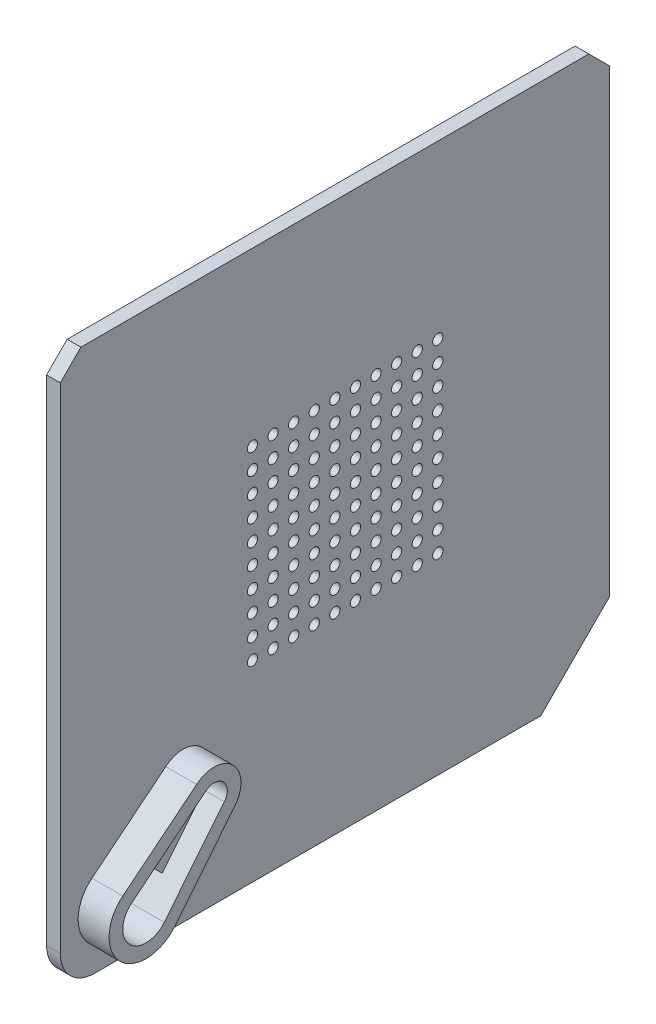
from build123d import *
from build123d.topology import SkipClean

# Parameters (mm, degrees)
SKETCH_1_R          = 0.75
EXTRUDE_1_DEPTH     = 2
EXTRUDE_2_DEPTH     = 1.5
EXTRUDE_3_DEPTH     = 1.5
CUT_EXTRUDE_1_DEPTH = 1.5
EXTRUDE_4_DEPTH     = 3
EXTRUDE_START       = 2
EXTRUDE_5_DEPTH     = 2


with BuildPart() as part:
    # 草图1 → 凸台-拉伸1 (new body)
    with BuildSketch(Plane(origin=(0, 0, 0), x_dir=(0, 0, -1), z_dir=(1, 0, 0))):
        with BuildLine():
            Line((70, 0), (80, 10))
            Line((80, 10), (80, 77))
            Line((80, 77), (77, 80))
            Line((77, 80), (3, 80))
            Line((3, 80), (0, 77))
            Line((0, 77), (0, 5))
            ThreePointArc((0, 5), (1.464466094, 1.464466094), (5, 0))
            Line((5, 0), (70, 0))
        make_face()
        with Locations((28, 55)):
            Circle(SKETCH_1_R, mode=Mode.SUBTRACT)
        with Locations((28, 52)):
            Circle(SKETCH_1_R, mode=Mode.SUBTRACT)
        with Locations((28, 49)):
            Circle(SKETCH_1_R, mode=Mode.SUBTRACT)
        with Locations((28, 46)):
            Circle(SKETCH_1_R, mode=Mode.SUBTRACT)
        with Locations((28, 43)):
            Circle(SKETCH_1_R, mode=Mode.SUBTRACT)
        with Locations((28, 40)):
            Circle(SKETCH_1_R, mode=Mode.SUBTRACT)
        with Locations((28, 37)):
            Circle(SKETCH_1_R, mode=Mode.SUBTRACT)
        with Locations((28, 34)):
            Circle(SKETCH_1_R, mode=Mode.SUBTRACT)
        with Locations((28, 31)):
            Circle(SKETCH_1_R, mode=Mode.SUBTRACT)
        with Locations((28, 28)):
            Circle(SKETCH_1_R, mode=Mode.SUBTRACT)
        with Locations((31, 52)):
            Circle(SKETCH_1_R, mode=Mode.SUBTRACT)
        with Locations((31, 49)):
            Circle(SKETCH_1_R, mode=Mode.SUBTRACT)
        with Locations((31, 46)):
            Circle(SKETCH_1_R, mode=Mode.SUBTRACT)
        with Locations((31, 43)):
            Circle(SKETCH_1_R, mode=Mode.SUBTRACT)
        with Locations((31, 40)):
            Circle(SKETCH_1_R, mode=Mode.SUBTRACT)
        with Locations((31, 37)):
            Circle(SKETCH_1_R, mode=Mode.SUBTRACT)
        with Locations((31, 34)):
            Circle(SKETCH_1_R, mode=Mode.SUBTRACT)
        with Locations((31, 31)):
            Circle(SKETCH_1_R, mode=Mode.SUBTRACT)
        with Locations((31, 28)):
            Circle(SKETCH_1_R, mode=Mode.SUBTRACT)
        with Locations((34, 52)):
            Circle(SKETCH_1_R, mode=Mode.SUBTRACT)
        with Locations((34, 49)):
            Circle(SKETCH_1_R, mode=Mode.SUBTRACT)
        with Locations((34, 46)):
            Circle(SKETCH_1_R, mode=Mode.SUBTRACT)
        with Locations((34, 43)):
            Circle(SKETCH_1_R, mode=Mode.SUBTRACT)
        with Locations((34, 40)):
            Circle(SKETCH_1_R, mode=Mode.SUBTRACT)
        with Locations((34, 37)):
            Circle(SKETCH_1_R, mode=Mode.SUBTRACT)
        with Locations((34, 34)):
            Circle(SKETCH_1_R, mode=Mode.SUBTRACT)
        with Locations((34, 31)):
            Circle(SKETCH_1_R, mode=Mode.SUBTRACT)
        with Locations((34, 28)):
            Circle(SKETCH_1_R, mode=Mode.SUBTRACT)
        with Locations((37, 52)):
            Circle(SKETCH_1_R, mode=Mode.SUBTRACT)
        with Locations((37, 49)):
            Circle(SKETCH_1_R, mode=Mode.SUBTRACT)
        with Locations((37, 46)):
            Circle(SKETCH_1_R, mode=Mode.SUBTRACT)
        with Locations((37, 43)):
            Circle(SKETCH_1_R, mode=Mode.SUBTRACT)
        with Locations((37, 40)):
            Circle(SKETCH_1_R, mode=Mode.SUBTRACT)
        with Locations((37, 37)):
            Circle(SKETCH_1_R, mode=Mode.SUBTRACT)
        with Locations((37, 34)):
            Circle(SKETCH_1_R, mode=Mode.SUBTRACT)
        with Locations((37, 31)):
            Circle(SKETCH_1_R, mode=Mode.SUBTRACT)
        with Locations((37, 28)):
            Circle(SKETCH_1_R, mode=Mode.SUBTRACT)
        with Locations((40, 52)):
            Circle(SKETCH_1_R, mode=Mode.SUBTRACT)
        with Locations((40, 49)):
            Circle(SKETCH_1_R, mode=Mode.SUBTRACT)
        with Locations((40, 46)):
            Circle(SKETCH_1_R, mode=Mode.SUBTRACT)
        with Locations((40, 43)):
            Circle(SKETCH_1_R, mode=Mode.SUBTRACT)
        with Locations((40, 40)):
            Circle(SKETCH_1_R, mode=Mode.SUBTRACT)
        with Locations((40, 37)):
            Circle(SKETCH_1_R, mode=Mode.SUBTRACT)
        with Locations((40, 34)):
            Circle(SKETCH_1_R, mode=Mode.SUBTRACT)
        with Locations((40, 31)):
            Circle(SKETCH_1_R, mode=Mode.SUBTRACT)
        with Locations((40, 28)):
            Circle(SKETCH_1_R, mode=Mode.SUBTRACT)
        with Locations((43, 52)):
            Circle(SKETCH_1_R, mode=Mode.SUBTRACT)
        with Locations((43, 49)):
            Circle(SKETCH_1_R, mode=Mode.SUBTRACT)
        with Locations((43, 46)):
            Circle(SKETCH_1_R, mode=Mode.SUBTRACT)
        with Locations((43, 43)):
            Circle(SKETCH_1_R, mode=Mode.SUBTRACT)
        with Locations((43, 40)):
            Circle(SKETCH_1_R, mode=Mode.SUBTRACT)
        with Locations((43, 37)):
            Circle(SKETCH_1_R, mode=Mode.SUBTRACT)
        with Locations((43, 34)):
            Circle(SKETCH_1_R, mode=Mode.SUBTRACT)
        with Locations((43, 31)):
            Circle(SKETCH_1_R, mode=Mode.SUBTRACT)
        with Locations((43, 28)):
            Circle(SKETCH_1_R, mode=Mode.SUBTRACT)
        with Locations((46, 52)):
            Circle(SKETCH_1_R, mode=Mode.SUBTRACT)
        with Locations((46, 49)):
            Circle(SKETCH_1_R, mode=Mode.SUBTRACT)
        with Locations((46, 46)):
            Circle(SKETCH_1_R, mode=Mode.SUBTRACT)
        with Locations((46, 43)):
            Circle(SKETCH_1_R, mode=Mode.SUBTRACT)
        with Locations((46, 40)):
            Circle(SKETCH_1_R, mode=Mode.SUBTRACT)
        with Locations((46, 37)):
            Circle(SKETCH_1_R, mode=Mode.SUBTRACT)
        with Locations((46, 34)):
            Circle(SKETCH_1_R, mode=Mode.SUBTRACT)
        with Locations((46, 31)):
            Circle(SKETCH_1_R, mode=Mode.SUBTRACT)
        with Locations((46, 28)):
            Circle(SKETCH_1_R, mode=Mode.SUBTRACT)
        with Locations((49, 52)):
            Circle(SKETCH_1_R, mode=Mode.SUBTRACT)
        with Locations((49, 49)):
            Circle(SKETCH_1_R, mode=Mode.SUBTRACT)
        with Locations((49, 46)):
            Circle(SKETCH_1_R, mode=Mode.SUBTRACT)
        with Locations((49, 43)):
            Circle(SKETCH_1_R, mode=Mode.SUBTRACT)
        with Locations((49, 40)):
            Circle(SKETCH_1_R, mode=Mode.SUBTRACT)
        with Locations((49, 37)):
            Circle(SKETCH_1_R, mode=Mode.SUBTRACT)
        with Locations((49, 34)):
            Circle(SKETCH_1_R, mode=Mode.SUBTRACT)
        with Locations((49, 31)):
            Circle(SKETCH_1_R, mode=Mode.SUBTRACT)
        with Locations((49, 28)):
            Circle(SKETCH_1_R, mode=Mode.SUBTRACT)
        with Locations((52, 52)):
            Circle(SKETCH_1_R, mode=Mode.SUBTRACT)
        with Locations((52, 49)):
            Circle(SKETCH_1_R, mode=Mode.SUBTRACT)
        with Locations((52, 46)):
            Circle(SKETCH_1_R, mode=Mode.SUBTRACT)
        with Locations((52, 43)):
            Circle(SKETCH_1_R, mode=Mode.SUBTRACT)
        with Locations((52, 40)):
            Circle(SKETCH_1_R, mode=Mode.SUBTRACT)
        with Locations((52, 37)):
            Circle(SKETCH_1_R, mode=Mode.SUBTRACT)
        with Locations((52, 34)):
            Circle(SKETCH_1_R, mode=Mode.SUBTRACT)
        with Locations((52, 31)):
            Circle(SKETCH_1_R, mode=Mode.SUBTRACT)
        with Locations((52, 28)):
            Circle(SKETCH_1_R, mode=Mode.SUBTRACT)
        with Locations((55, 52)):
            Circle(SKETCH_1_R, mode=Mode.SUBTRACT)
        with Locations((55, 49)):
            Circle(SKETCH_1_R, mode=Mode.SUBTRACT)
        with Locations((55, 46)):
            Circle(SKETCH_1_R, mode=Mode.SUBTRACT)
        with Locations((55, 43)):
            Circle(SKETCH_1_R, mode=Mode.SUBTRACT)
        with Locations((55, 40)):
            Circle(SKETCH_1_R, mode=Mode.SUBTRACT)
        with Locations((55, 37)):
            Circle(SKETCH_1_R, mode=Mode.SUBTRACT)
        with Locations((55, 34)):
            Circle(SKETCH_1_R, mode=Mode.SUBTRACT)
        with Locations((55, 31)):
            Circle(SKETCH_1_R, mode=Mode.SUBTRACT)
        with Locations((55, 28)):
            Circle(SKETCH_1_R, mode=Mode.SUBTRACT)
        with Locations((31, 55)):
            Circle(SKETCH_1_R, mode=Mode.SUBTRACT)
        with Locations((34, 55)):
            Circle(SKETCH_1_R, mode=Mode.SUBTRACT)
        with Locations((37, 55)):
            Circle(SKETCH_1_R, mode=Mode.SUBTRACT)
        with Locations((40, 55)):
            Circle(SKETCH_1_R, mode=Mode.SUBTRACT)
        with Locations((43, 55)):
            Circle(SKETCH_1_R, mode=Mode.SUBTRACT)
        with Locations((46, 55)):
            Circle(SKETCH_1_R, mode=Mode.SUBTRACT)
        with Locations((49, 55)):
            Circle(SKETCH_1_R, mode=Mode.SUBTRACT)
        with Locations((52, 55)):
            Circle(SKETCH_1_R, mode=Mode.SUBTRACT)
        with Locations((55, 55)):
            Circle(SKETCH_1_R, mode=Mode.SUBTRACT)
        with BuildLine():
            Line((5.862390923, 10.64397947), (16.641711638, 19.358863251))
            ThreePointArc((16.641711638, 19.358863251), (19.240260163, 19.28301339), (19.397612625, 16.688124599))
            Line((19.397612625, 16.688124599), (10.643833158, 5.862209966))
            ThreePointArc((10.643833158, 5.862209966), (5.595754671, 5.59591922), (5.862390923, 10.64397947))
        make_face(mode=Mode.SUBTRACT)
    extrude(amount=EXTRUDE_1_DEPTH)

    # 草图2 → 凸台-拉伸2 (add)
    with SkipClean():  # the faces are left unmerged after this step: merging them gives an invalid solid
        with BuildSketch(Plane(origin=(2, 0, 0), x_dir=(0, 0, -1), z_dir=(1, 0, 0))):
            with BuildLine():
                Line((15.364143139, 20.897853258), (4.60497382, 12.199261511))
                ThreePointArc((4.60497382, 12.199261511), (4.181492713, 4.181754055), (12.199029134, 4.604686416))
                Line((12.199029134, 4.604686416), (20.952808601, 15.43060105))
                ThreePointArc((20.952808601, 15.43060105), (20.64536143, 20.706339884), (15.364143139, 20.897853258))
            make_face()
            with BuildLine():
                Line((10.643833158, 5.862209966), (19.397612625, 16.688124599))
                ThreePointArc((19.397612625, 16.688124599), (19.240260163, 19.28301339), (16.641711638, 19.358863251))
                Line((16.641711638, 19.358863251), (5.862390923, 10.64397947))
                ThreePointArc((5.862390923, 10.64397947), (5.595754671, 5.59591922), (10.643833158, 5.862209966))
            make_face(mode=Mode.SUBTRACT)
        extrude(amount=EXTRUDE_2_DEPTH)

    # 草图3 → 凸台-拉伸3 (add)
    with SkipClean():  # the faces are left unmerged after this step: merging them gives an invalid solid
        with BuildSketch(Plane.ZY):
            with BuildLine():
                Line((-16.641711638, 19.358863251), (-9.206287127, 13.347458433))
                Line((-9.206287127, 13.347458433), (-13.347667709, 9.20607785))
                Line((-13.347667709, 9.20607785), (-19.397612625, 16.688124599))
                ThreePointArc((-19.397612625, 16.688124599), (-19.240260163, 19.28301339), (-16.641711638, 19.358863251))
            make_face()
        extrude(amount=-EXTRUDE_3_DEPTH)

    # 草图4 → 切除-拉伸1 (cut)
    with SkipClean():  # the faces are left unmerged after this step: merging them gives an invalid solid
        with BuildSketch(Plane(origin=(1.5, 0, 0), x_dir=(0, 0, -1), z_dir=(1, 0, 0))):
            with BuildLine():
                Line((11.788077332, 12.409835362), (13.555844285, 14.177602315))
                ThreePointArc((13.555844285, 14.177602315), (14.404372422, 14.177602315), (14.404372422, 13.329074178))
                Line((14.404372422, 13.329074178), (12.636605469, 11.561307225))
                ThreePointArc((12.636605469, 11.561307225), (11.788077332, 11.561307225), (11.788077332, 12.409835362))
            make_face()
            with BuildLine():
                Line((15.018432468, 15.640190499), (16.786199421, 17.407957452))
                ThreePointArc((16.786199421, 17.407957452), (17.634727559, 17.407957452), (17.634727559, 16.559429314))
                Line((17.634727559, 16.559429314), (15.866960606, 14.791662361))
                ThreePointArc((15.866960606, 14.791662361), (15.018432468, 14.791662361), (15.018432468, 15.640190499))
            make_face()
        extrude(amount=-CUT_EXTRUDE_1_DEPTH, mode=Mode.SUBTRACT)

    # 草图5 → 凸台-拉伸4 (add)
    with SkipClean():  # the faces are left unmerged after this step: merging them gives an invalid solid
        with BuildSketch(Plane(origin=(3.5, 0, 0), x_dir=(0, 0, -1), z_dir=(1, 0, 0))):
            with BuildLine():
                ThreePointArc((20.952808601, 15.43060105), (20.64536143, 20.706339884), (15.364143139, 20.897853258))
                Line((15.364143139, 20.897853258), (4.60497382, 12.199261511))
                ThreePointArc((4.60497382, 12.199261511), (4.181492713, 4.181754055), (12.199029134, 4.604686416))
                Line((12.199029134, 4.604686416), (20.952808601, 15.43060105))
            make_face()
            with BuildLine():
                Line((13.347667709, 9.20607785), (10.643833158, 5.862209966))
                ThreePointArc((10.643833158, 5.862209966), (5.595754671, 5.59591922), (5.862390923, 10.64397947))
                Line((5.862390923, 10.64397947), (16.641711638, 19.358863251))
                ThreePointArc((16.641711638, 19.358863251), (19.240260163, 19.28301339), (19.397612625, 16.688124599))
                Line((19.397612625, 16.688124599), (13.347667709, 9.20607785))
            make_face(mode=Mode.SUBTRACT)
        extrude(amount=EXTRUDE_4_DEPTH)

    # 草图6 → 凸台-拉伸5 (add)
    with SkipClean():  # the faces are left unmerged after this step: merging them gives an invalid solid
        with BuildSketch(Plane(origin=(1.5, 0, 0), x_dir=(0, 0, -1), z_dir=(1, 0, 0)).offset(EXTRUDE_START)):
            with BuildLine():
                Line((16.641711638, 19.358863251), (9.206287127, 13.347458433))
                Line((9.206287127, 13.347458433), (13.347667709, 9.20607785))
                Line((13.347667709, 9.20607785), (19.397612625, 16.688124599))
                ThreePointArc((19.397612625, 16.688124599), (19.240260163, 19.28301339), (16.641711638, 19.358863251))
            make_face()
            with BuildLine():
                Line((12.636605469, 11.561307225), (14.404372422, 13.329074178))
                ThreePointArc((14.404372422, 13.329074178), (14.404372422, 14.177602315), (13.555844285, 14.177602315))
                Line((13.555844285, 14.177602315), (11.788077332, 12.409835362))
                ThreePointArc((11.788077332, 12.409835362), (11.788077332, 11.561307225), (12.636605469, 11.561307225))
            make_face(mode=Mode.SUBTRACT)
            with BuildLine():
                Line((15.866960606, 14.791662361), (17.634727559, 16.559429314))
                ThreePointArc((17.634727559, 16.559429314), (17.634727559, 17.407957452), (16.786199421, 17.407957452))
                Line((16.786199421, 17.407957452), (15.018432468, 15.640190499))
                ThreePointArc((15.018432468, 15.640190499), (15.018432468, 14.791662361), (15.866960606, 14.791662361))
            make_face(mode=Mode.SUBTRACT)
        extrude(amount=-EXTRUDE_5_DEPTH)


solid = part.part
